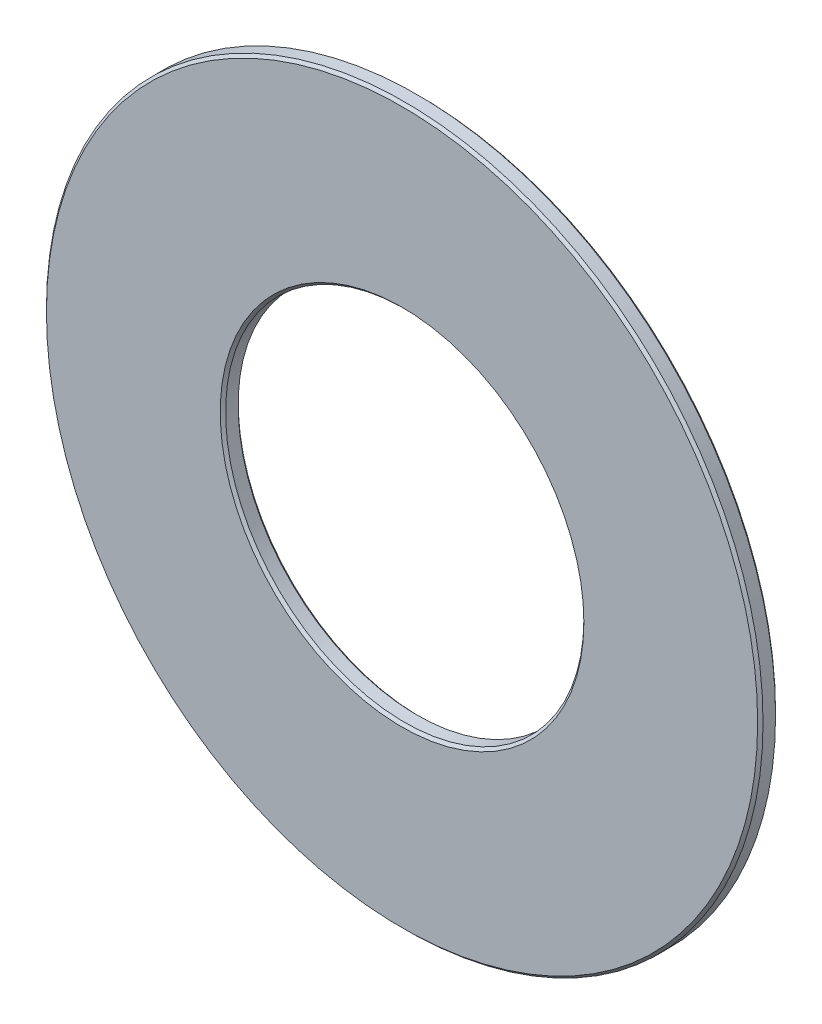
from build123d import *

# Parameters (mm, degrees)
SKETCH_1_R      = 4
SKETCH_1_R_2    = 2
EXTRUDE_1_DEPTH = 0.1
CHAMFER_1_SIZE  = 0.03


with BuildPart() as part:
    # 草图1 → 凸台-拉伸1 (new, symmetric)
    with BuildSketch(Plane.XY):
        Circle(SKETCH_1_R)
        Circle(SKETCH_1_R_2, mode=Mode.SUBTRACT)
    extrude(amount=EXTRUDE_1_DEPTH, both=True)

    # 倒角1
    chamfer_1_edges = [part.edges().sort_by_distance(p)[0] for p in [
        (-4, 0, -0.1),
        (-4, 0, 0.1),
        (-2, 0, -0.1),
        (-2, 0, 0.1),
    ]]
    chamfer(chamfer_1_edges, length=CHAMFER_1_SIZE)


solid = part.part
